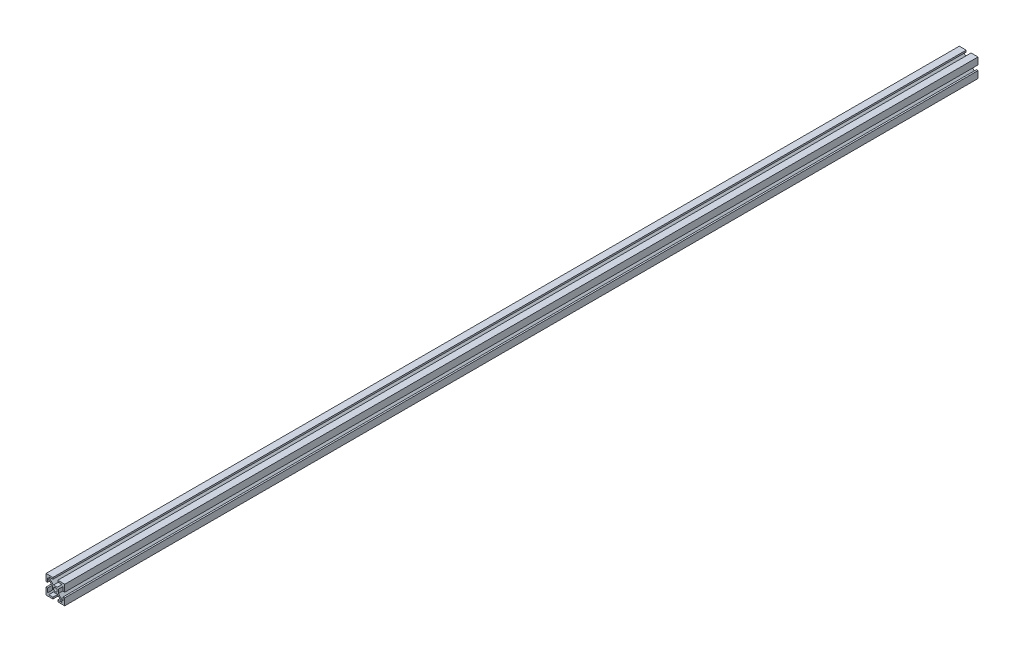
from build123d import *

# Parameters (mm, degrees)
SKETCH1_R           = 2.5
BOSS_EXTRUDE1_DEPTH = 1220


with BuildPart() as part:
    # Sketch1 → Boss-Extrude1 (new body)
    with BuildSketch(Plane.XY):
        Polygon((8.45, 15.036791488), (2.14, 21.346791488), (2.14, 15.75), (0, 15.75), (0, 25), (9.25, 25), (9.25, 22.86), (3.653208512, 22.86), (9.963208512, 16.55), (15.036791488, 16.55), (21.346791488, 22.86), (15.75, 22.86), (15.75, 25), (25, 25), (25, 15.75), (22.86, 15.75), (22.86, 21.346791488), (16.55, 15.036791488), (16.55, 9.963208512), (22.86, 3.653208512), (22.86, 9.25), (25, 9.25), (25, 0), (15.75, 0), (15.75, 2.14), (21.346791488, 2.14), (15.036791488, 8.45), (9.963208512, 8.45), (3.653208512, 2.14), (9.25, 2.14), (9.25, 0), (0, 0), (0, 9.25), (2.14, 9.25), (2.14, 3.653208512), (8.45, 9.963208512), align=None)
        with Locations((12.5, 12.5)):
            Circle(SKETCH1_R, mode=Mode.SUBTRACT)
    extrude(amount=BOSS_EXTRUDE1_DEPTH)


solid = part.part
